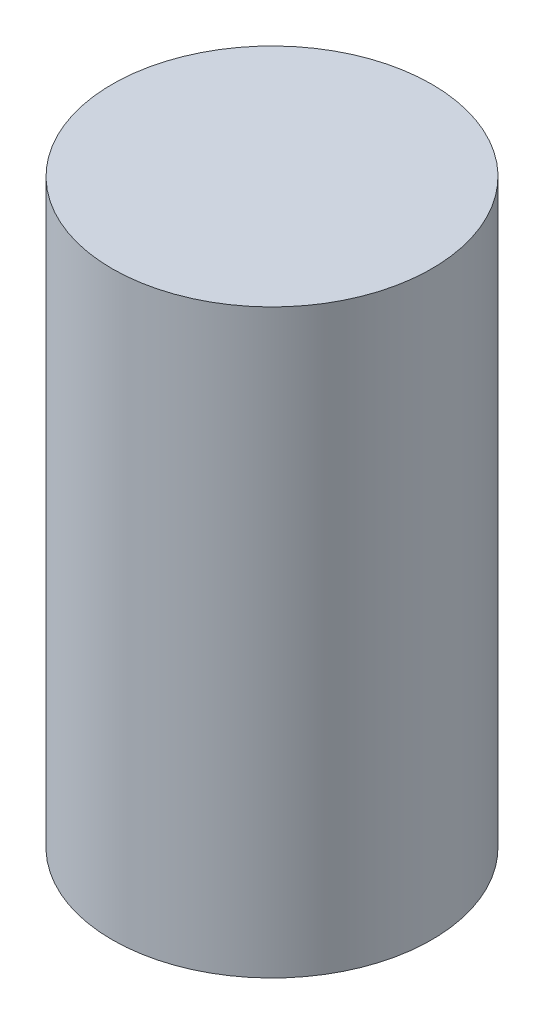
from build123d import *

# Parameters (mm, degrees)
SKETCH1_R           = 13.75
BOSS_EXTRUDE1_DEPTH = 50


with BuildPart() as part:
    # Sketch1 → Boss-Extrude1 (new body)
    with BuildSketch(Plane(origin=(0, 0, 0), x_dir=(1, 0, 0), z_dir=(0, 1, 0))):
        with Locations(Location((0, 0, 0), (0, 0, 270))):
            Circle(SKETCH1_R)
    extrude(amount=BOSS_EXTRUDE1_DEPTH)


solid = part.part
